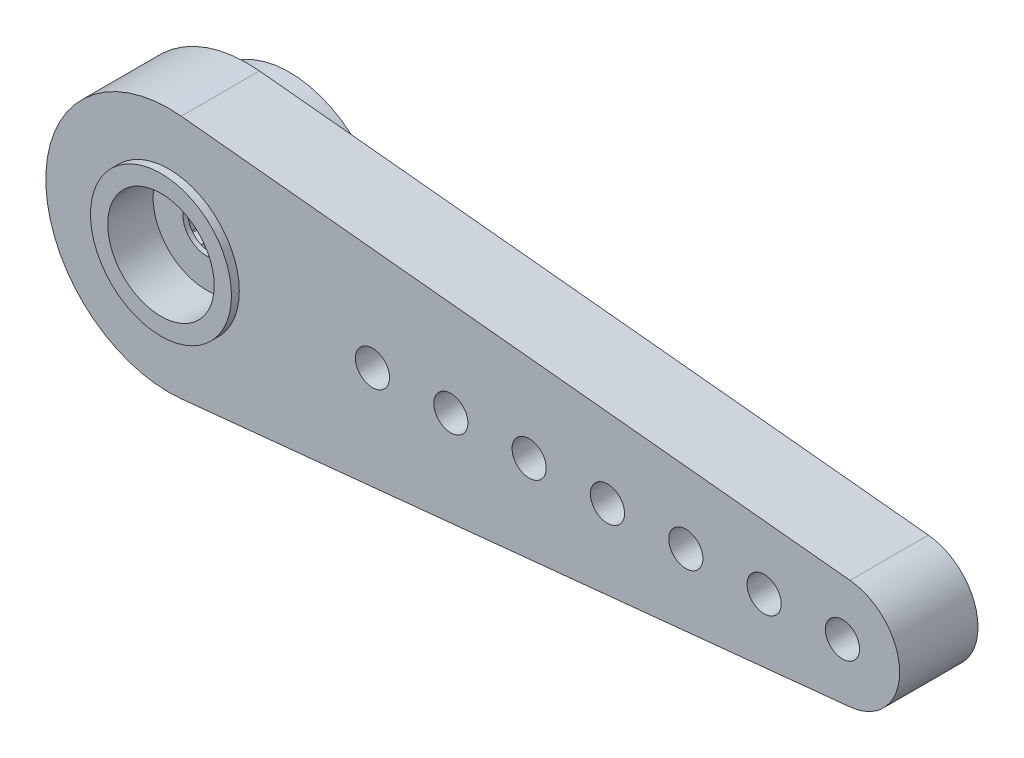
from build123d import *

# Parameters (mm, degrees)
BOSS_EXTRUDE1_DEPTH = 5
CUT_EXTRUDE1_REACH  = 49.569
SKETCH2_R           = 1.5
SKETCH3_R           = 3.4
CUT_EXTRUDE2_DEPTH  = 2.4
BOSS_EXTRUDE2_START = 0.5
SKETCH4_R           = 4.5
SKETCH4_R_2         = 3.4
BOSS_EXTRUDE2_DEPTH = 0.5
SKETCH6_R           = 6
SKETCH6_R_2         = 1.5
BOSS_EXTRUDE3_DEPTH = 2.7
SKETCH7_R           = 3.75
CUT_EXTRUDE4_DEPTH  = 5
BOSS_EXTRUDE4_DEPTH = 5
CIRPATTERN2_COUNT   = 15
CUT_EXTRUDE5_REACH  = 49.928
SKETCH10_R          = 1.09


with BuildPart() as part:
    # Sketch1 → Boss-Extrude1 (new body)
    with BuildSketch(Plane.XY):
        with BuildLine():
            Line((0.788456111, 7.810303257), (43.485538544, 3.5))
            ThreePointArc((43.485538544, 3.5), (46.65, 0), (43.485538544, -3.5))
            Line((43.485538544, -3.5), (0.788456111, -7.810303257))
            ThreePointArc((0.788456111, -7.810303257), (-7.85, 0), (0.788456111, 7.810303257))
        make_face()
    extrude(amount=BOSS_EXTRUDE1_DEPTH)

    # Sketch2 → Cut-Extrude1 (cut, up to next)
    with BuildSketch(Plane.XY.offset(5), mode=Mode.PRIVATE) as cut_extrude1_sk1:
        Circle(SKETCH2_R)
    cut_extrude1_tool1 = extrude(cut_extrude1_sk1.sketch, amount=-CUT_EXTRUDE1_REACH, mode=Mode.PRIVATE) & part.part
    add(cut_extrude1_tool1.solids().sort_by_distance((0, 0, 5))[0], mode=Mode.SUBTRACT)

    # Sketch3 → Cut-Extrude2 (cut)
    with BuildSketch(Plane.XY.offset(5)):
        Circle(SKETCH3_R)
    extrude(amount=-CUT_EXTRUDE2_DEPTH, mode=Mode.SUBTRACT)

    # Sketch4 → Boss-Extrude2 (add)
    with BuildSketch(Plane.XY.offset(5).offset(BOSS_EXTRUDE2_START)):
        Circle(SKETCH4_R)
        Circle(SKETCH4_R_2, mode=Mode.SUBTRACT)
    extrude(amount=-BOSS_EXTRUDE2_DEPTH)

    # Sketch6 → Boss-Extrude3 (add)
    with BuildSketch(Plane(origin=(0, 0, 0), x_dir=(-1, 0, 0), z_dir=(0, 0, -1))):
        with Locations(Location((0, 0, 0), (0, 0, 180))):
            Circle(SKETCH6_R)
        with Locations(Location((0, 0, 0), (0, 0, 180))):
            Circle(SKETCH6_R_2, mode=Mode.SUBTRACT)
    extrude(amount=BOSS_EXTRUDE3_DEPTH)

    # Sketch7 → Cut-Extrude4 (cut)
    with BuildSketch(Plane(origin=(0, 0, -2.7), x_dir=(-1, 0, 0), z_dir=(0, 0, -1))):
        Circle(SKETCH7_R)
    extrude(amount=-CUT_EXTRUDE4_DEPTH, mode=Mode.SUBTRACT)

    # Sketch8 → Boss-Extrude4 (add)
    with BuildSketch(Plane(origin=(0, 0, -2.7), x_dir=(-1, 0, 0), z_dir=(0, 0, -1))):
        with BuildLine():
            Line((-0.738744308, 3.676514225), (0, 3.25))
            Line((0, 3.25), (0.738744308, 3.676514225))
            ThreePointArc((0.738744308, 3.676514225), (0, 3.75), (-0.738744308, 3.676514225))
        make_face()
    boss_extrude4 = extrude(amount=-BOSS_EXTRUDE4_DEPTH)

    # CirPattern2: Boss-Extrude4 ×15 about axis
    cirpattern2_axis = Axis((0, 0, 0), (0, 0, 1))
    for i in range(1, CIRPATTERN2_COUNT):
        add(boss_extrude4.rotate(cirpattern2_axis, i * 360 / CIRPATTERN2_COUNT))

    # Sketch10 → Cut-Extrude5 (cut, up to next)
    with BuildSketch(Plane.XY.offset(5), mode=Mode.PRIVATE) as cut_extrude5_sk1:
        with Locations((43, 0)):
            Circle(SKETCH10_R)
    cut_extrude5_tool1 = extrude(cut_extrude5_sk1.sketch, amount=-CUT_EXTRUDE5_REACH, mode=Mode.PRIVATE) & part.part
    # Sketch10 → Cut-Extrude5 (cut, up to next)
    with BuildSketch(Plane.XY.offset(5), mode=Mode.PRIVATE) as cut_extrude5_sk2:
        with Locations((38, 0)):
            Circle(SKETCH10_R)
    cut_extrude5_tool2 = extrude(cut_extrude5_sk2.sketch, amount=-CUT_EXTRUDE5_REACH, mode=Mode.PRIVATE) & part.part
    # Sketch10 → Cut-Extrude5 (cut, up to next)
    with BuildSketch(Plane.XY.offset(5), mode=Mode.PRIVATE) as cut_extrude5_sk3:
        with Locations((33, 0)):
            Circle(SKETCH10_R)
    cut_extrude5_tool3 = extrude(cut_extrude5_sk3.sketch, amount=-CUT_EXTRUDE5_REACH, mode=Mode.PRIVATE) & part.part
    # Sketch10 → Cut-Extrude5 (cut, up to next)
    with BuildSketch(Plane.XY.offset(5), mode=Mode.PRIVATE) as cut_extrude5_sk4:
        with Locations((28, 0)):
            Circle(SKETCH10_R)
    cut_extrude5_tool4 = extrude(cut_extrude5_sk4.sketch, amount=-CUT_EXTRUDE5_REACH, mode=Mode.PRIVATE) & part.part
    # Sketch10 → Cut-Extrude5 (cut, up to next)
    with BuildSketch(Plane.XY.offset(5), mode=Mode.PRIVATE) as cut_extrude5_sk5:
        with Locations((23, 0)):
            Circle(SKETCH10_R)
    cut_extrude5_tool5 = extrude(cut_extrude5_sk5.sketch, amount=-CUT_EXTRUDE5_REACH, mode=Mode.PRIVATE) & part.part
    # Sketch10 → Cut-Extrude5 (cut, up to next)
    with BuildSketch(Plane.XY.offset(5), mode=Mode.PRIVATE) as cut_extrude5_sk6:
        with Locations((18, 0)):
            Circle(SKETCH10_R)
    cut_extrude5_tool6 = extrude(cut_extrude5_sk6.sketch, amount=-CUT_EXTRUDE5_REACH, mode=Mode.PRIVATE) & part.part
    # Sketch10 → Cut-Extrude5 (cut, up to next)
    with BuildSketch(Plane.XY.offset(5), mode=Mode.PRIVATE) as cut_extrude5_sk7:
        with Locations((13, 0)):
            Circle(SKETCH10_R)
    cut_extrude5_tool7 = extrude(cut_extrude5_sk7.sketch, amount=-CUT_EXTRUDE5_REACH, mode=Mode.PRIVATE) & part.part
    add(cut_extrude5_tool1.solids().sort_by_distance((43, 0, 5))[0], mode=Mode.SUBTRACT)
    add(cut_extrude5_tool2.solids().sort_by_distance((38, 0, 5))[0], mode=Mode.SUBTRACT)
    add(cut_extrude5_tool3.solids().sort_by_distance((33, 0, 5))[0], mode=Mode.SUBTRACT)
    add(cut_extrude5_tool4.solids().sort_by_distance((28, 0, 5))[0], mode=Mode.SUBTRACT)
    add(cut_extrude5_tool5.solids().sort_by_distance((23, 0, 5))[0], mode=Mode.SUBTRACT)
    add(cut_extrude5_tool6.solids().sort_by_distance((18, 0, 5))[0], mode=Mode.SUBTRACT)
    add(cut_extrude5_tool7.solids().sort_by_distance((13, 0, 5))[0], mode=Mode.SUBTRACT)


solid = part.part
